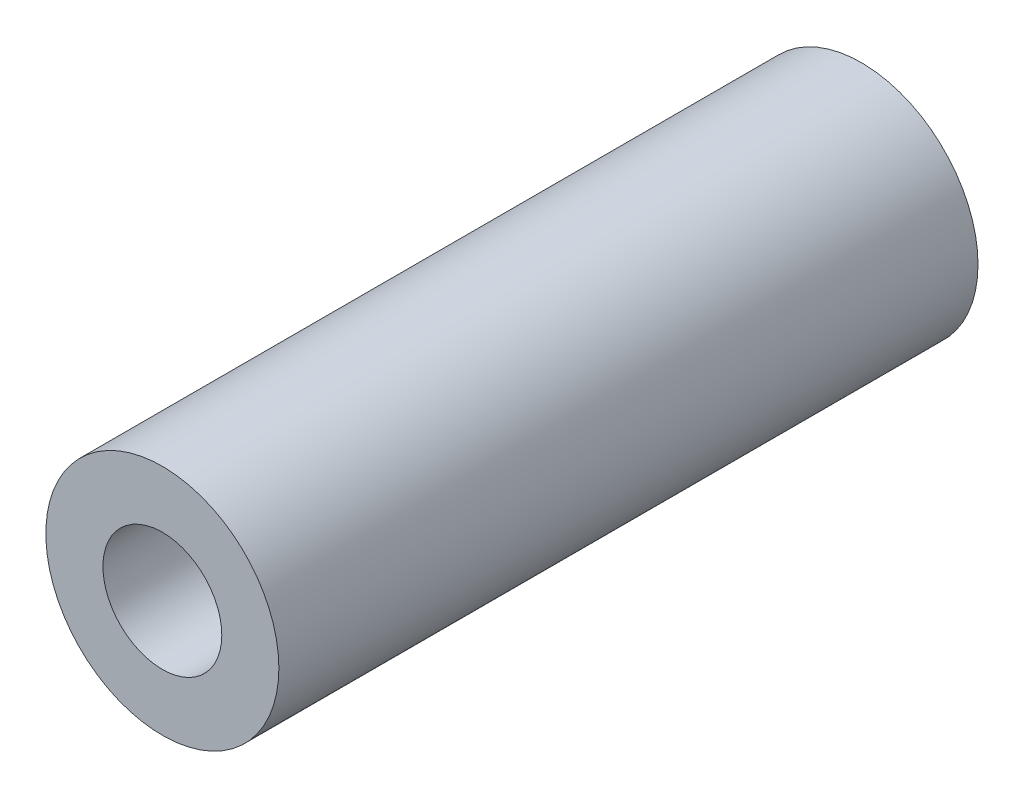
from build123d import *

# Parameters (mm, degrees)
MAINBODY_EXTRUDE_START  = -15
PROJECTIONXY_SKETCH_R   = 5
MAINBODY_EXTRUDE_DEPTH  = 30
CUT_EXTRUDE1_DEPTH      = 17.583123952
CUT_EXTRUDE1_DEPTH_BACK = 17.583123952
BORE_SKETCH_R           = 2.55


with BuildPart() as part:
    # projectionXy_sketch → mainBody_extrude (new body)
    with BuildSketch(Plane.XY.offset(MAINBODY_EXTRUDE_START)):
        Circle(PROJECTIONXY_SKETCH_R)
    extrude(amount=MAINBODY_EXTRUDE_DEPTH)

    # bore_sketch → Cut-Extrude1 (cut, two sides: drawn at the far end of the back side and taken through both)
    with BuildSketch(Plane.XY.offset(-CUT_EXTRUDE1_DEPTH_BACK)):
        Circle(BORE_SKETCH_R)
    extrude(amount=CUT_EXTRUDE1_DEPTH + CUT_EXTRUDE1_DEPTH_BACK, mode=Mode.SUBTRACT)


solid = part.part
